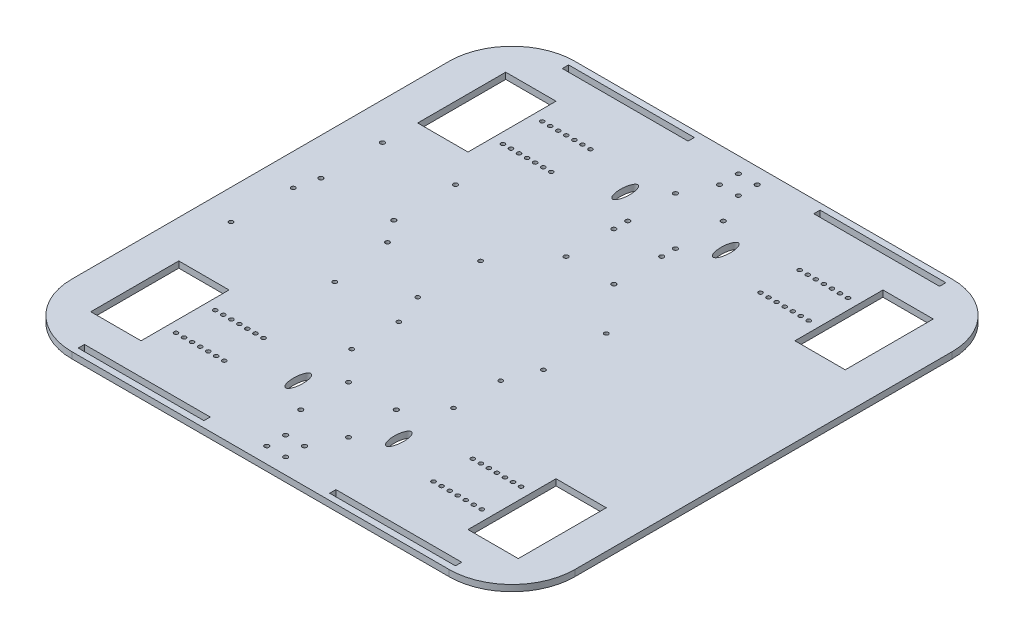
from build123d import *

# Parameters (mm, degrees)
SKETCH1_W           = 400
SKETCH1_H           = 400
SKETCH1_R           = 1.75
SKETCH1_W_2         = 40
SKETCH1_H_2         = 70
BOSS_EXTRUDE2_DEPTH = 5
FILLET1_R           = 50
SKETCH2_R           = 1.6
CUT_EXTRUDE1_DEPTH  = 5
SKETCH3_R           = 1.65
CUT_EXTRUDE2_DEPTH  = 10
SKETCH4_R           = 1.75
CUT_EXTRUDE3_DEPTH  = 10
SKETCH5_R           = 1.75
CUT_EXTRUDE4_DEPTH  = 10
SKETCH6_RX          = 10
SKETCH6_RY          = 3.75
CUT_EXTRUDE5_DEPTH  = 10
SKETCH7_R           = 1.65
CUT_EXTRUDE6_DEPTH  = 10
SKETCH8_R           = 1.65
CUT_EXTRUDE7_DEPTH  = 5
SKETCH9_W           = 100
SKETCH9_H           = 5
CUT_EXTRUDE8_DEPTH  = 10


with BuildPart() as part:
    # Sketch1 → Boss-Extrude2 (new body)
    with BuildSketch(Plane(origin=(0, 0, 0), x_dir=(1, 0, 0), z_dir=(0, 1, 0))):
        Rectangle(SKETCH1_W, SKETCH1_H)
        with Locations(Location((-7.5, 187.5, 0), (0, 0, 270))):
            Circle(SKETCH1_R, mode=Mode.SUBTRACT)
        with Locations(Location((7.5, 187.5, 0), (0, 0, 270))):
            Circle(SKETCH1_R, mode=Mode.SUBTRACT)
        with Locations(Location((7.5, 172.5, 0), (0, 0, 270))):
            Circle(SKETCH1_R, mode=Mode.SUBTRACT)
        with Locations(Location((-7.5, 172.5, 0), (0, 0, 270))):
            Circle(SKETCH1_R, mode=Mode.SUBTRACT)
        with Locations(Location((7.5, -187.5, 0), (0, 0, 270))):
            Circle(SKETCH1_R, mode=Mode.SUBTRACT)
        with Locations(Location((-7.5, -187.5, 0), (0, 0, 270))):
            Circle(SKETCH1_R, mode=Mode.SUBTRACT)
        with Locations(Location((-7.5, -172.5, 0), (0, 0, 270))):
            Circle(SKETCH1_R, mode=Mode.SUBTRACT)
        with Locations(Location((7.5, -172.5, 0), (0, 0, 270))):
            Circle(SKETCH1_R, mode=Mode.SUBTRACT)
        with Locations((-150, 130)):
            Rectangle(SKETCH1_W_2, SKETCH1_H_2, mode=Mode.SUBTRACT)
        with Locations((150, 130)):
            Rectangle(SKETCH1_W_2, SKETCH1_H_2, mode=Mode.SUBTRACT)
        with Locations((150, -130)):
            Rectangle(SKETCH1_W_2, SKETCH1_H_2, mode=Mode.SUBTRACT)
        with Locations((-150, -130)):
            Rectangle(SKETCH1_W_2, SKETCH1_H_2, mode=Mode.SUBTRACT)
    extrude(amount=BOSS_EXTRUDE2_DEPTH)

    # Fillet1
    fillet1_edges = [part.edges().sort_by_distance(p)[0] for p in [
        (200, 2.5, 200),
        (-200, 2.5, 200),
        (-200, 2.5, -200),
        (200, 2.5, -200),
    ]]
    fillet(fillet1_edges, radius=FILLET1_R)

    # Sketch2 → Cut-Extrude1 (cut)
    with BuildSketch(Plane(origin=(0, 5, 0), x_dir=(1, 0, 0), z_dir=(0, 1, 0))):
        with Locations(Location((-121.6, 145.6, 0), (0, 0, 270))):
            Circle(SKETCH2_R)
        with Locations(Location((-115.2, 145.6, 0), (0, 0, 270))):
            Circle(SKETCH2_R)
        with Locations(Location((-108.8, 145.6, 0), (0, 0, 270))):
            Circle(SKETCH2_R)
        with Locations(Location((-102.4, 145.6, 0), (0, 0, 270))):
            Circle(SKETCH2_R)
        with Locations(Location((-96, 145.6, 0), (0, 0, 270))):
            Circle(SKETCH2_R)
        with Locations(Location((-89.6, 145.6, 0), (0, 0, 270))):
            Circle(SKETCH2_R)
        with Locations(Location((-83.2, 145.6, 0), (0, 0, 270))):
            Circle(SKETCH2_R)
        with Locations(Location((-83.2, 114.4, 0), (0, 0, 90))):
            Circle(SKETCH2_R)
        with Locations(Location((-89.6, 114.4, 0), (0, 0, 90))):
            Circle(SKETCH2_R)
        with Locations(Location((-96, 114.4, 0), (0, 0, 90))):
            Circle(SKETCH2_R)
        with Locations(Location((-102.4, 114.4, 0), (0, 0, 90))):
            Circle(SKETCH2_R)
        with Locations(Location((-108.8, 114.4, 0), (0, 0, 90))):
            Circle(SKETCH2_R)
        with Locations(Location((-115.2, 114.4, 0), (0, 0, 90))):
            Circle(SKETCH2_R)
        with Locations(Location((-121.6, 114.4, 0), (0, 0, 90))):
            Circle(SKETCH2_R)
        with Locations(Location((83.2, 114.4, 0), (0, 0, 270))):
            Circle(SKETCH2_R)
        with Locations(Location((89.6, 114.4, 0), (0, 0, 270))):
            Circle(SKETCH2_R)
        with Locations(Location((96, 114.4, 0), (0, 0, 270))):
            Circle(SKETCH2_R)
        with Locations(Location((102.4, 114.4, 0), (0, 0, 270))):
            Circle(SKETCH2_R)
        with Locations(Location((108.8, 114.4, 0), (0, 0, 270))):
            Circle(SKETCH2_R)
        with Locations(Location((115.2, 114.4, 0), (0, 0, 270))):
            Circle(SKETCH2_R)
        with Locations(Location((121.6, 114.4, 0), (0, 0, 270))):
            Circle(SKETCH2_R)
        with Locations(Location((83.2, 145.6, 0), (0, 0, 90))):
            Circle(SKETCH2_R)
        with Locations(Location((89.6, 145.6, 0), (0, 0, 90))):
            Circle(SKETCH2_R)
        with Locations(Location((96, 145.6, 0), (0, 0, 90))):
            Circle(SKETCH2_R)
        with Locations(Location((102.4, 145.6, 0), (0, 0, 90))):
            Circle(SKETCH2_R)
        with Locations(Location((108.8, 145.6, 0), (0, 0, 90))):
            Circle(SKETCH2_R)
        with Locations(Location((115.2, 145.6, 0), (0, 0, 90))):
            Circle(SKETCH2_R)
        with Locations(Location((121.6, 145.6, 0), (0, 0, 90))):
            Circle(SKETCH2_R)
        with Locations(Location((121.6, -145.6, 0), (0, 0, 270))):
            Circle(SKETCH2_R)
        with Locations(Location((115.2, -145.6, 0), (0, 0, 270))):
            Circle(SKETCH2_R)
        with Locations(Location((108.8, -145.6, 0), (0, 0, 270))):
            Circle(SKETCH2_R)
        with Locations(Location((102.4, -145.6, 0), (0, 0, 270))):
            Circle(SKETCH2_R)
        with Locations(Location((96, -145.6, 0), (0, 0, 270))):
            Circle(SKETCH2_R)
        with Locations(Location((89.6, -145.6, 0), (0, 0, 270))):
            Circle(SKETCH2_R)
        with Locations(Location((83.2, -145.6, 0), (0, 0, 270))):
            Circle(SKETCH2_R)
        with Locations(Location((121.6, -114.4, 0), (0, 0, 90))):
            Circle(SKETCH2_R)
        with Locations(Location((115.2, -114.4, 0), (0, 0, 90))):
            Circle(SKETCH2_R)
        with Locations(Location((108.8, -114.4, 0), (0, 0, 90))):
            Circle(SKETCH2_R)
        with Locations(Location((102.4, -114.4, 0), (0, 0, 90))):
            Circle(SKETCH2_R)
        with Locations(Location((96, -114.4, 0), (0, 0, 90))):
            Circle(SKETCH2_R)
        with Locations(Location((89.6, -114.4, 0), (0, 0, 90))):
            Circle(SKETCH2_R)
        with Locations(Location((83.2, -114.4, 0), (0, 0, 90))):
            Circle(SKETCH2_R)
        with Locations(Location((-121.6, -114.4, 0), (0, 0, 270))):
            Circle(SKETCH2_R)
        with Locations(Location((-115.2, -114.4, 0), (0, 0, 270))):
            Circle(SKETCH2_R)
        with Locations(Location((-108.8, -114.4, 0), (0, 0, 270))):
            Circle(SKETCH2_R)
        with Locations(Location((-102.4, -114.4, 0), (0, 0, 270))):
            Circle(SKETCH2_R)
        with Locations(Location((-96, -114.4, 0), (0, 0, 270))):
            Circle(SKETCH2_R)
        with Locations(Location((-89.6, -114.4, 0), (0, 0, 270))):
            Circle(SKETCH2_R)
        with Locations(Location((-83.2, -114.4, 0), (0, 0, 270))):
            Circle(SKETCH2_R)
        with Locations(Location((-83.2, -145.6, 0), (0, 0, 90))):
            Circle(SKETCH2_R)
        with Locations(Location((-89.6, -145.6, 0), (0, 0, 90))):
            Circle(SKETCH2_R)
        with Locations(Location((-96, -145.6, 0), (0, 0, 90))):
            Circle(SKETCH2_R)
        with Locations(Location((-102.4, -145.6, 0), (0, 0, 90))):
            Circle(SKETCH2_R)
        with Locations(Location((-108.8, -145.6, 0), (0, 0, 90))):
            Circle(SKETCH2_R)
        with Locations(Location((-115.2, -145.6, 0), (0, 0, 90))):
            Circle(SKETCH2_R)
        with Locations(Location((-121.6, -145.6, 0), (0, 0, 90))):
            Circle(SKETCH2_R)
    extrude(amount=-CUT_EXTRUDE1_DEPTH, mode=Mode.SUBTRACT)

    # Sketch3 → Cut-Extrude2 (cut)
    with BuildSketch(Plane(origin=(0, 5, 0), x_dir=(1, 0, 0), z_dir=(0, 1, 0))):
        with Locations(Location((-176.03, -47.46, 0), (0, 0, 270))):
            Circle(SKETCH3_R)
        with Locations(Location((-174.76, 0.8, 0), (0, 0, 270))):
            Circle(SKETCH3_R)
        with Locations(Location((-93.48, -47.46, 0), (0, 0, 270))):
            Circle(SKETCH3_R)
        with Locations(Location((-99.83, 0.8, 0), (0, 0, 270))):
            Circle(SKETCH3_R)
    extrude(amount=-CUT_EXTRUDE2_DEPTH, mode=Mode.SUBTRACT)

    # Sketch4 → Cut-Extrude3 (cut)
    with BuildSketch(Plane(origin=(0, 5, 0), x_dir=(1, 0, 0), z_dir=(0, 1, 0))):
        with Locations(Location((-19, 149, 0), (0, 0, 270))):
            Circle(SKETCH4_R)
        with Locations(Location((19, 149, 0), (0, 0, 270))):
            Circle(SKETCH4_R)
        with Locations(Location((19, 111, 0), (0, 0, 270))):
            Circle(SKETCH4_R)
        with Locations(Location((-19, 111, 0), (0, 0, 270))):
            Circle(SKETCH4_R)
        with Locations(Location((-19, 100, 0), (0, 0, 270))):
            Circle(SKETCH4_R)
        with Locations(Location((19, 100, 0), (0, 0, 270))):
            Circle(SKETCH4_R)
        with Locations(Location((19, 62, 0), (0, 0, 270))):
            Circle(SKETCH4_R)
        with Locations(Location((-19, 62, 0), (0, 0, 270))):
            Circle(SKETCH4_R)
        with Locations(Location((-19, -149, 0), (0, 0, 270))):
            Circle(SKETCH4_R)
        with Locations(Location((19, -149, 0), (0, 0, 270))):
            Circle(SKETCH4_R)
        with Locations(Location((-19, -111, 0), (0, 0, 270))):
            Circle(SKETCH4_R)
        with Locations(Location((19, -111, 0), (0, 0, 270))):
            Circle(SKETCH4_R)
    extrude(amount=-CUT_EXTRUDE3_DEPTH, mode=Mode.SUBTRACT)

    # Sketch5 → Cut-Extrude4 (cut)
    with BuildSketch(Plane(origin=(0, 5, 0), x_dir=(1, 0, 0), z_dir=(0, 1, 0))):
        with Locations(Location((-170.5, 67.5, 0), (0, 0, 270))):
            Circle(SKETCH5_R)
        with Locations(Location((-112.5, 67.5, 0), (0, 0, 270))):
            Circle(SKETCH5_R)
        with Locations(Location((-112.5, 18.5, 0), (0, 0, 270))):
            Circle(SKETCH5_R)
        with Locations(Location((-170.5, 18.5, 0), (0, 0, 270))):
            Circle(SKETCH5_R)
    extrude(amount=-CUT_EXTRUDE4_DEPTH, mode=Mode.SUBTRACT)

    # Sketch6 → Cut-Extrude5 (cut)
    with BuildSketch(Plane(origin=(0, 5, 0), x_dir=(1, 0, 0), z_dir=(0, 1, 0))):
        with Locations(Location((-40, 130), (0, 0, 90))):
            Ellipse(SKETCH6_RX, SKETCH6_RY)
        with Locations(Location((40, 130), (0, 0, 90))):
            Ellipse(SKETCH6_RX, SKETCH6_RY)
        with Locations(Location((40, -130), (0, 0, -90))):
            Ellipse(SKETCH6_RX, SKETCH6_RY)
        with Locations(Location((-40, -130), (0, 0, -90))):
            Ellipse(SKETCH6_RX, SKETCH6_RY)
    extrude(amount=-CUT_EXTRUDE5_DEPTH, mode=Mode.SUBTRACT)

    # Sketch7 → Cut-Extrude6 (cut)
    with BuildSketch(Plane(origin=(0, 5, 0), x_dir=(1, 0, 0), z_dir=(0, 1, 0))):
        with Locations(Location((-50, 25, 0), (0, 0, 270))):
            Circle(SKETCH7_R)
        with Locations(Location((50, 25, 0), (0, 0, 270))):
            Circle(SKETCH7_R)
        with Locations(Location((50, -25, 0), (0, 0, 270))):
            Circle(SKETCH7_R)
        with Locations(Location((-50, -25, 0), (0, 0, 270))):
            Circle(SKETCH7_R)
    extrude(amount=-CUT_EXTRUDE6_DEPTH, mode=Mode.SUBTRACT)

    # Sketch8 → Cut-Extrude7 (cut)
    with BuildSketch(Plane(origin=(0, 5, 0), x_dir=(1, 0, 0), z_dir=(0, 1, 0))):
        with Locations(Location((-40.5, -49.5, 0), (0, 0, 270))):
            Circle(SKETCH8_R)
        with Locations(Location((40.5, -49.5, 0), (0, 0, 90))):
            Circle(SKETCH8_R)
        with Locations(Location((40.5, -87, 0), (0, 0, 270))):
            Circle(SKETCH8_R)
        with Locations(Location((-40.5, -87, 0), (0, 0, 90))):
            Circle(SKETCH8_R)
    extrude(amount=-CUT_EXTRUDE7_DEPTH, mode=Mode.SUBTRACT)

    # Sketch9 → Cut-Extrude8 (cut)
    with BuildSketch(Plane(origin=(0, 5, 0), x_dir=(1, 0, 0), z_dir=(0, 1, 0))):
        with Locations((-100, 192.5)):
            Rectangle(SKETCH9_W, SKETCH9_H)
        with Locations((100, 192.5)):
            Rectangle(SKETCH9_W, SKETCH9_H)
        with Locations((100, -192.5)):
            Rectangle(SKETCH9_W, SKETCH9_H)
        with Locations((-100, -192.5)):
            Rectangle(SKETCH9_W, SKETCH9_H)
    extrude(amount=-CUT_EXTRUDE8_DEPTH, mode=Mode.SUBTRACT)


solid = part.part
